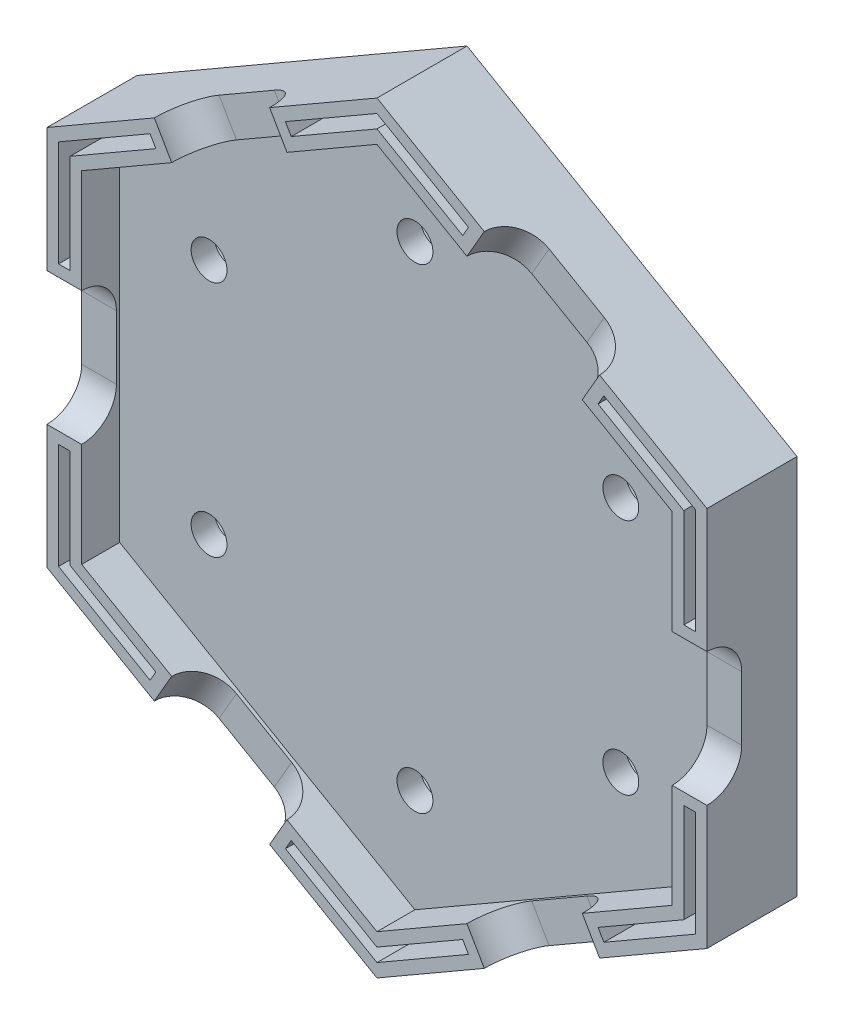
from build123d import *

# Parameters (mm, degrees)
SKETCH1_R           = 1.55
BOSS_EXTRUDE1_DEPTH = 4.5
SKETCH1_4_R         = 1.55
CUT_EXTRUDE1_DEPTH  = 2.5
BOSS_EXTRUDE2_DEPTH = 7.78
CUT_EXTRUDE2_REACH  = 68.276
CUT_EXTRUDE3_REACH  = 74.144
CUT_EXTRUDE4_REACH  = 74.144
CUT_EXTRUDE5_DEPTH  = 5


with BuildPart() as part:
    # Sketch1 → Boss-Extrude1 (new body)
    # profile 1 of 8: a face of its own
    with BuildSketch(Plane(origin=(0, 0, 0), x_dir=(0, 1, 0), z_dir=(0, 0, 1))):
        Polygon((-16.454482672, -28.5), (16.454482672, -28.5), (32.908965344, 0), (16.454482672, 28.5), (-16.454482672, 28.5), (-32.908965344, 0), align=None)
        Polygon((14.722431864, -25.5), (29.444863729, 0), (14.722431864, 25.5), (-14.722431864, 25.5), (-29.444863729, 0), (-14.722431864, -25.5), align=None, mode=Mode.SUBTRACT)
    # profile 2 of 8: a face of its own
    with BuildSketch(Plane(origin=(0, 0, 0), x_dir=(0, 1, 0), z_dir=(0, 0, 1))):
        Polygon((-14.722431864, -25.5), (14.722431864, -25.5), (29.444863729, 0), (14.722431864, 25.5), (-14.722431864, 25.5), (-29.444863729, 0), align=None)
        Polygon((-18.798769192, -3), (-17.066718385, 0), (-18.798769192, 3), (-22.262870808, 3), (-23.994921615, 0), (-22.262870808, -3), align=None, mode=Mode.SUBTRACT)
        Polygon((-8.533359192, -20.780211681), (-6.801308385, -17.780211681), (-8.533359192, -14.780211681), (-11.997460808, -14.780211681), (-13.729511615, -17.780211681), (-11.997460808, -20.780211681), align=None, mode=Mode.SUBTRACT)
        Polygon((11.997460808, -20.780211681), (13.729511615, -17.780211681), (11.997460808, -14.780211681), (8.533359192, -14.780211681), (6.801308385, -17.780211681), (8.533359192, -20.780211681), align=None, mode=Mode.SUBTRACT)
        Polygon((22.262870808, -3), (23.994921615, 0), (22.262870808, 3), (18.798769192, 3), (17.066718385, 0), (18.798769192, -3), align=None, mode=Mode.SUBTRACT)
        Polygon((11.997460808, 14.780211681), (13.729511615, 17.780211681), (11.997460808, 20.780211681), (8.533359192, 20.780211681), (6.801308385, 17.780211681), (8.533359192, 14.780211681), align=None, mode=Mode.SUBTRACT)
        Polygon((-8.533359192, 14.780211681), (-6.801308385, 17.780211681), (-8.533359192, 20.780211681), (-11.997460808, 20.780211681), (-13.729511615, 17.780211681), (-11.997460808, 14.780211681), align=None, mode=Mode.SUBTRACT)
    # profile 3 of 8: a face of its own
    with BuildSketch(Plane(origin=(0, 0, 0), x_dir=(0, 1, 0), z_dir=(0, 0, 1))):
        Polygon((8.533359192, -20.780211681), (11.997460808, -20.780211681), (13.729511615, -17.780211681), (11.997460808, -14.780211681), (8.533359192, -14.780211681), (6.801308385, -17.780211681), align=None)
        with Locations(Location((10.26541, -17.780211681, 0), (0, 0, 270))):
            Circle(SKETCH1_R, mode=Mode.SUBTRACT)
    # profile 4 of 8: a face of its own
    with BuildSketch(Plane(origin=(0, 0, 0), x_dir=(0, 1, 0), z_dir=(0, 0, 1))):
        Polygon((-11.997460808, -20.780211681), (-8.533359192, -20.780211681), (-6.801308385, -17.780211681), (-8.533359192, -14.780211681), (-11.997460808, -14.780211681), (-13.729511615, -17.780211681), align=None)
        with Locations(Location((-10.26541, -17.780211681, 0), (0, 0, 270))):
            Circle(SKETCH1_R, mode=Mode.SUBTRACT)
    # profile 5 of 8: a face of its own
    with BuildSketch(Plane(origin=(0, 0, 0), x_dir=(0, 1, 0), z_dir=(0, 0, 1))):
        Polygon((-22.262870808, -3), (-18.798769192, -3), (-17.066718385, 0), (-18.798769192, 3), (-22.262870808, 3), (-23.994921615, 0), align=None)
        with Locations(Location((-20.53082, 0, 0), (0, 0, 270))):
            Circle(SKETCH1_R, mode=Mode.SUBTRACT)
    # profile 6 of 8: a face of its own
    with BuildSketch(Plane(origin=(0, 0, 0), x_dir=(0, 1, 0), z_dir=(0, 0, 1))):
        Polygon((-11.997460808, 14.780211681), (-8.533359192, 14.780211681), (-6.801308385, 17.780211681), (-8.533359192, 20.780211681), (-11.997460808, 20.780211681), (-13.729511615, 17.780211681), align=None)
        with Locations(Location((-10.26541, 17.780211681, 0), (0, 0, 270))):
            Circle(SKETCH1_R, mode=Mode.SUBTRACT)
    # profile 7 of 8: a face of its own
    with BuildSketch(Plane(origin=(0, 0, 0), x_dir=(0, 1, 0), z_dir=(0, 0, 1))):
        Polygon((8.533359192, 14.780211681), (11.997460808, 14.780211681), (13.729511615, 17.780211681), (11.997460808, 20.780211681), (8.533359192, 20.780211681), (6.801308385, 17.780211681), align=None)
        with Locations(Location((10.26541, 17.780211681, 0), (0, 0, 270))):
            Circle(SKETCH1_R, mode=Mode.SUBTRACT)
    # profile 8 of 8: a face of its own
    with BuildSketch(Plane(origin=(0, 0, 0), x_dir=(0, 1, 0), z_dir=(0, 0, 1))):
        Polygon((18.798769192, -3), (22.262870808, -3), (23.994921615, 0), (22.262870808, 3), (18.798769192, 3), (17.066718385, 0), align=None)
        with Locations(Location((20.53082, 0, 0), (0, 0, 270))):
            Circle(SKETCH1_R, mode=Mode.SUBTRACT)
    extrude(amount=BOSS_EXTRUDE1_DEPTH)

    # Sketch1<4> → Cut-Extrude1 (cut)
    # profile 1 of 6: a face of its own
    with BuildSketch(Plane(origin=(0, 0, 0), x_dir=(0, 1, 0), z_dir=(0, 0, 1))):
        Polygon((-11.997460808, 14.780211681), (-8.533359192, 14.780211681), (-6.801308385, 17.780211681), (-8.533359192, 20.780211681), (-11.997460808, 20.780211681), (-13.729511615, 17.780211681), align=None)
        with Locations(Location((-10.26541, 17.780211681, 0), (0, 0, 270))):
            Circle(SKETCH1_4_R, mode=Mode.SUBTRACT)
    # profile 2 of 6: a face of its own
    with BuildSketch(Plane(origin=(0, 0, 0), x_dir=(0, 1, 0), z_dir=(0, 0, 1))):
        Polygon((-22.262870808, -3), (-18.798769192, -3), (-17.066718385, 0), (-18.798769192, 3), (-22.262870808, 3), (-23.994921615, 0), align=None)
        with Locations(Location((-20.53082, 0, 0), (0, 0, 270))):
            Circle(SKETCH1_4_R, mode=Mode.SUBTRACT)
    # profile 3 of 6: a face of its own
    with BuildSketch(Plane(origin=(0, 0, 0), x_dir=(0, 1, 0), z_dir=(0, 0, 1))):
        Polygon((-11.997460808, -20.780211681), (-8.533359192, -20.780211681), (-6.801308385, -17.780211681), (-8.533359192, -14.780211681), (-11.997460808, -14.780211681), (-13.729511615, -17.780211681), align=None)
        with Locations(Location((-10.26541, -17.780211681, 0), (0, 0, 270))):
            Circle(SKETCH1_4_R, mode=Mode.SUBTRACT)
    # profile 4 of 6: a face of its own
    with BuildSketch(Plane(origin=(0, 0, 0), x_dir=(0, 1, 0), z_dir=(0, 0, 1))):
        Polygon((8.533359192, -20.780211681), (11.997460808, -20.780211681), (13.729511615, -17.780211681), (11.997460808, -14.780211681), (8.533359192, -14.780211681), (6.801308385, -17.780211681), align=None)
        with Locations(Location((10.26541, -17.780211681, 0), (0, 0, 270))):
            Circle(SKETCH1_4_R, mode=Mode.SUBTRACT)
    # profile 5 of 6: a face of its own
    with BuildSketch(Plane(origin=(0, 0, 0), x_dir=(0, 1, 0), z_dir=(0, 0, 1))):
        Polygon((18.798769192, -3), (22.262870808, -3), (23.994921615, 0), (22.262870808, 3), (18.798769192, 3), (17.066718385, 0), align=None)
        with Locations(Location((20.53082, 0, 0), (0, 0, 270))):
            Circle(SKETCH1_4_R, mode=Mode.SUBTRACT)
    # profile 6 of 6: a face of its own
    with BuildSketch(Plane(origin=(0, 0, 0), x_dir=(0, 1, 0), z_dir=(0, 0, 1))):
        Polygon((8.533359192, 14.780211681), (11.997460808, 14.780211681), (13.729511615, 17.780211681), (11.997460808, 20.780211681), (8.533359192, 20.780211681), (6.801308385, 17.780211681), align=None)
        with Locations(Location((10.26541, 17.780211681, 0), (0, 0, 270))):
            Circle(SKETCH1_4_R, mode=Mode.SUBTRACT)
    extrude(amount=CUT_EXTRUDE1_DEPTH, mode=Mode.SUBTRACT)

    # Sketch1<5> → Boss-Extrude2 (add)
    with BuildSketch(Plane(origin=(0, 0, 0), x_dir=(0, 1, 0), z_dir=(0, 0, 1))):
        Polygon((-16.454482672, -28.5), (16.454482672, -28.5), (32.908965344, 0), (16.454482672, 28.5), (-16.454482672, 28.5), (-32.908965344, 0), align=None)
        Polygon((14.722431864, -25.5), (29.444863729, 0), (14.722431864, 25.5), (-14.722431864, 25.5), (-29.444863729, 0), (-14.722431864, -25.5), align=None, mode=Mode.SUBTRACT)
    extrude(amount=BOSS_EXTRUDE2_DEPTH)

    # Cut-Extrude2: up to this face of the body (flat: up to its plane)
    cut_extrude2_end = Plane(part.part.faces().sort_by_distance((28.5, 0, 3.89))[0])
    # Sketch2 → Cut-Extrude2 (cut, up to the picked face)
    with BuildSketch(Plane(origin=(-28.5, 0, 0), x_dir=(0, -1, 0), z_dir=(-1, 0, 0)), mode=Mode.PRIVATE) as cut_extrude2_sk1:
        with BuildLine():
            Line((-2.75, 10.78), (2.75, 10.78))
            ThreePointArc((2.75, 10.78), (5.75, 7.78), (2.75, 4.78))
            Line((2.75, 4.78), (-2.75, 4.78))
            ThreePointArc((-2.75, 4.78), (-5.75, 7.78), (-2.75, 10.78))
        make_face()
    cut_extrude2_tool1 = split(extrude(cut_extrude2_sk1.sketch, amount=-CUT_EXTRUDE2_REACH, mode=Mode.PRIVATE), bisect_by=cut_extrude2_end, keep=Keep.BOTH, mode=Mode.PRIVATE)
    add(cut_extrude2_tool1.solids().sort_by(Axis((-28.5, 0, 7.78), (1, 0, 0)))[0], mode=Mode.SUBTRACT)

    # Cut-Extrude3: up to this face of the body (flat: up to its plane)
    cut_extrude3_end = Plane(part.part.faces().sort_by_distance((14.25, 24.681724008, 3.89))[0])
    # Sketch3 → Cut-Extrude3 (cut, up to the picked face)
    with BuildSketch(Plane(origin=(-14.25, -24.681724008, 0), x_dir=(0.8660254037844387, -0.49999999999999983, 0), z_dir=(-0.49999999999999983, -0.8660254037844387, 0)), mode=Mode.PRIVATE) as cut_extrude3_sk1:
        with BuildLine():
            Line((-2.75, 10.78), (2.75, 10.78))
            ThreePointArc((2.75, 10.78), (5.75, 7.78), (2.75, 4.78))
            Line((2.75, 4.78), (-2.75, 4.78))
            ThreePointArc((-2.75, 4.78), (-5.75, 7.78), (-2.75, 10.78))
        make_face()
    cut_extrude3_tool1 = split(extrude(cut_extrude3_sk1.sketch, amount=-CUT_EXTRUDE3_REACH, mode=Mode.PRIVATE), bisect_by=cut_extrude3_end, keep=Keep.BOTH, mode=Mode.PRIVATE)
    add(cut_extrude3_tool1.solids().sort_by(Axis((-14.25, -24.681724, 7.78), (0.49999999999999983, 0.8660254037844387, 0)))[0], mode=Mode.SUBTRACT)

    # Cut-Extrude4: up to this face of the body (flat: up to its plane)
    cut_extrude4_end = Plane(part.part.faces().sort_by_distance((-14.25, 24.681724008, 3.89))[0])
    # Sketch4 → Cut-Extrude4 (cut, up to the picked face)
    with BuildSketch(Plane(origin=(14.25, -24.681724008, 0), x_dir=(0.8660254037844385, 0.5000000000000004, 0), z_dir=(0.5000000000000003, -0.8660254037844384, 0)), mode=Mode.PRIVATE) as cut_extrude4_sk1:
        with BuildLine():
            Line((-2.75, 10.78), (2.75, 10.78))
            ThreePointArc((2.75, 10.78), (5.75, 7.78), (2.75, 4.78))
            Line((2.75, 4.78), (-2.75, 4.78))
            ThreePointArc((-2.75, 4.78), (-5.75, 7.78), (-2.75, 10.78))
        make_face()
    cut_extrude4_tool1 = split(extrude(cut_extrude4_sk1.sketch, amount=-CUT_EXTRUDE4_REACH, mode=Mode.PRIVATE), bisect_by=cut_extrude4_end, keep=Keep.BOTH, mode=Mode.PRIVATE)
    add(cut_extrude4_tool1.solids().sort_by(Axis((14.25, -24.681724, 7.78), (-0.5000000000000003, 0.8660254037844384, 0)))[0], mode=Mode.SUBTRACT)

    # Sketch7 → Cut-Extrude5 (cut)
    with BuildSketch(Plane.XY.offset(7.78)):
        Polygon((-26.5, -6.75), (-26.5, -15.299782134), (-19.095671476, -19.5746732), (-19.595671476, -20.440698604), (-27.5, -15.877132403), (-27.5, -6.75), align=None)
        Polygon((-27.5, 6.75), (-26.5, 6.75), (-26.5, 15.299782134), (-19.095671476, 19.5746732), (-19.595671476, 20.440698604), (-27.5, 15.877132403), align=None)
        Polygon((-7.404328524, -26.3246732), (0, -30.599564267), (7.404328524, -26.3246732), (7.904328524, -27.190698604), (0, -31.754264805), (-7.904328524, -27.190698604), align=None)
        Polygon((19.095671476, -19.5746732), (26.5, -15.299782134), (26.5, -6.75), (27.5, -6.75), (27.5, -15.877132403), (19.595671476, -20.440698604), align=None)
        Polygon((26.5, 6.75), (26.5, 15.299782134), (19.095671476, 19.5746732), (19.595671476, 20.440698604), (27.5, 15.877132403), (27.5, 6.75), align=None)
        Polygon((7.404328524, 26.3246732), (0, 30.599564267), (-7.404328524, 26.3246732), (-7.904328524, 27.190698604), (0, 31.754264805), (7.904328524, 27.190698604), align=None)
    extrude(amount=-CUT_EXTRUDE5_DEPTH, mode=Mode.SUBTRACT)


solid = part.part
